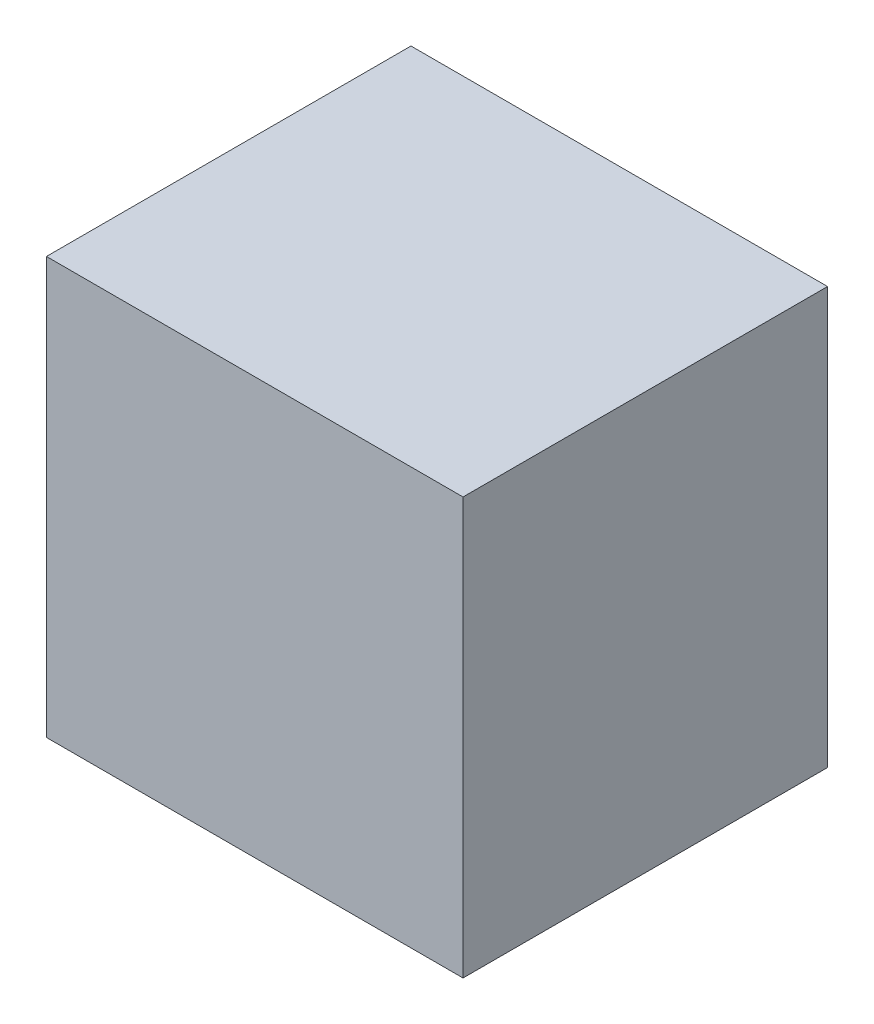
from build123d import *

# Parameters (mm, degrees)
SKETCH4_W           = 40
SKETCH4_H           = 40
BOSS_EXTRUDE2_DEPTH = 35
CUT_EXTRUDE1_START  = -3
SKETCH5_W           = 34
SKETCH5_H           = 34
CUT_EXTRUDE1_DEPTH  = 29


with BuildPart() as part:
    # Sketch4 → Boss-Extrude2 (new body)
    with BuildSketch(Plane(origin=(0, 0, -10), x_dir=(-1, 0, 0), z_dir=(0, 0, -1))):
        with Locations((-105, 0)):
            Rectangle(SKETCH4_W, SKETCH4_H)
    extrude(amount=BOSS_EXTRUDE2_DEPTH)

    # Sketch5 → Cut-Extrude1 (cut)
    with BuildSketch(Plane(origin=(0, 0, -45), x_dir=(-1, 0, 0), z_dir=(0, 0, -1)).offset(CUT_EXTRUDE1_START)):
        with Locations((-105, 0)):
            Rectangle(SKETCH5_W, SKETCH5_H)
    extrude(amount=-CUT_EXTRUDE1_DEPTH, mode=Mode.SUBTRACT)


solid = part.part
